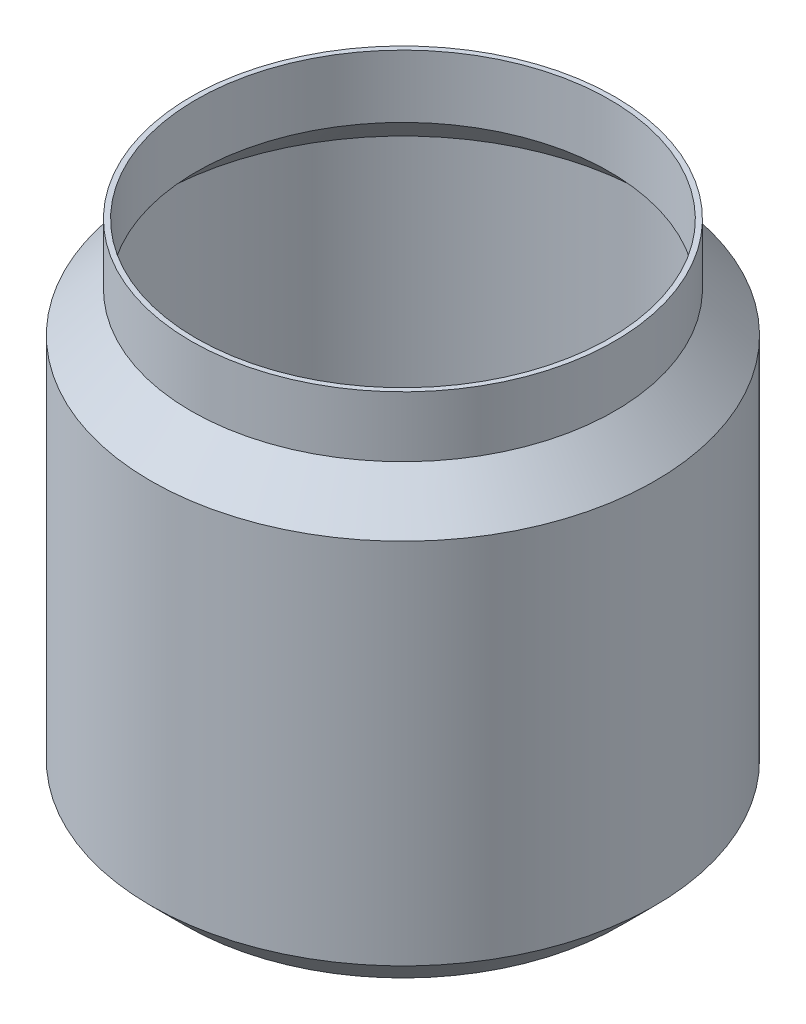
from build123d import *


with BuildPart() as part:
    # Esquisse2 → Révolution1 (revolve)
    with BuildSketch(Plane.XY, mode=Mode.PRIVATE) as r_volution1_sk:
        Polygon((0, 0), (42.928932188, 0), (50, 7.071067812), (50, 80), (42, 88), (42, 100), (41, 100), (41, 87.585786438), (49, 79.585786438), (49, 7.485281374), (42.514718626, 1), (0, 1), align=None)
    revolve(r_volution1_sk.sketch.rotate(Axis((0, 105, 0), (0, -1, 0)), 90), axis=Axis((0, 105, 0), (0, -1, 0)))


solid = part.part
